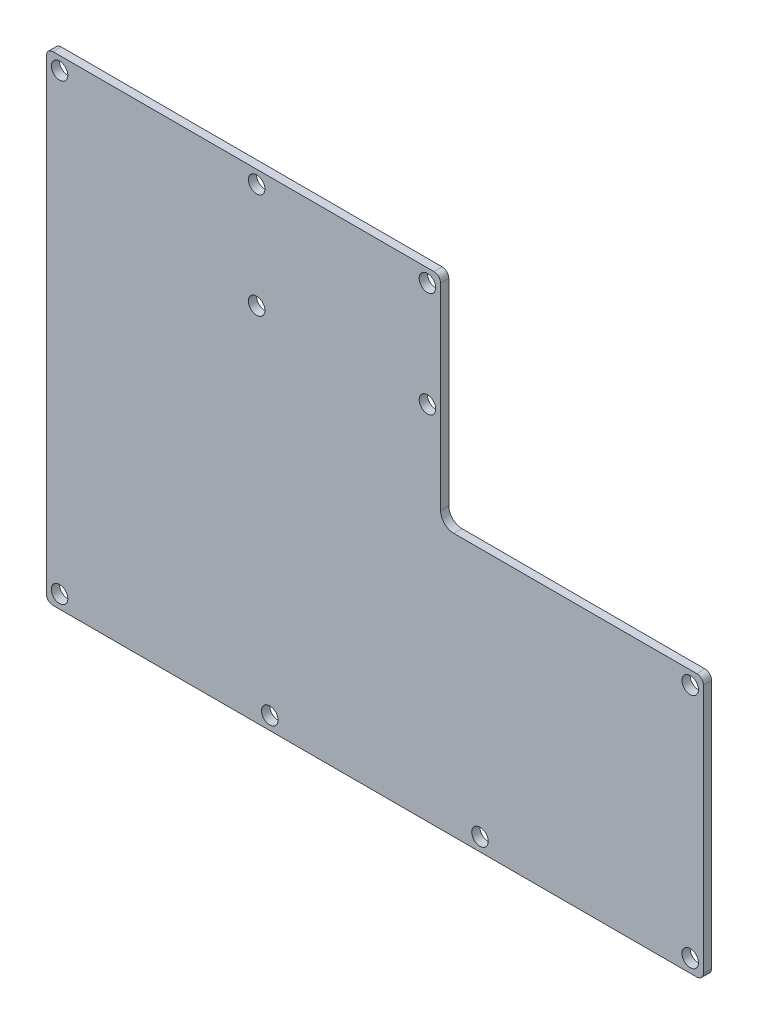
from build123d import *

# Parameters (mm, degrees)
MODEL_R             = 1.6
BOSS_EXTRUDE1_DEPTH = 1.5875


with BuildPart() as part:
    # Model → Boss-Extrude1 (new body)
    with BuildSketch(Plane.XY):
        with BuildLine():
            Line((127, 49.53), (127, 1.27))
            ThreePointArc((127, 1.27), (126.628025612, 0.371974388), (125.73, 0))
            Line((125.73, 0), (1.27, 0))
            ThreePointArc((1.27, 0), (0.371974388, 0.371974388), (0, 1.27))
            Line((0, 1.27), (0, 91.44))
            ThreePointArc((0, 91.44), (0.371974388, 92.338025612), (1.27, 92.71))
            Line((1.27, 92.71), (74.93, 92.71))
            ThreePointArc((74.93, 92.71), (75.828025612, 92.338025612), (76.2, 91.44))
            Line((76.2, 91.44), (76.2, 53.34))
            ThreePointArc((76.2, 53.34), (76.943948776, 51.543948776), (78.74, 50.8))
            Line((78.74, 50.8), (125.73, 50.8))
            ThreePointArc((125.73, 50.8), (126.628025612, 50.428025612), (127, 49.53))
        make_face()
        with Locations((2.54, 2.54)):
            Circle(MODEL_R, mode=Mode.SUBTRACT)
        with Locations((124.46, 2.54)):
            Circle(MODEL_R, mode=Mode.SUBTRACT)
        with Locations((2.54, 90.17)):
            Circle(MODEL_R, mode=Mode.SUBTRACT)
        with Locations((43.18, 2.54)):
            Circle(MODEL_R, mode=Mode.SUBTRACT)
        with Locations((83.82, 2.54)):
            Circle(MODEL_R, mode=Mode.SUBTRACT)
        with Locations((124.46, 48.26)):
            Circle(MODEL_R, mode=Mode.SUBTRACT)
        with Locations((73.66, 69.85)):
            Circle(MODEL_R, mode=Mode.SUBTRACT)
        with Locations((40.64, 69.85)):
            Circle(MODEL_R, mode=Mode.SUBTRACT)
        with Locations((40.64, 90.17)):
            Circle(MODEL_R, mode=Mode.SUBTRACT)
        with Locations((73.66, 90.17)):
            Circle(MODEL_R, mode=Mode.SUBTRACT)
    extrude(amount=-BOSS_EXTRUDE1_DEPTH)


solid = part.part
